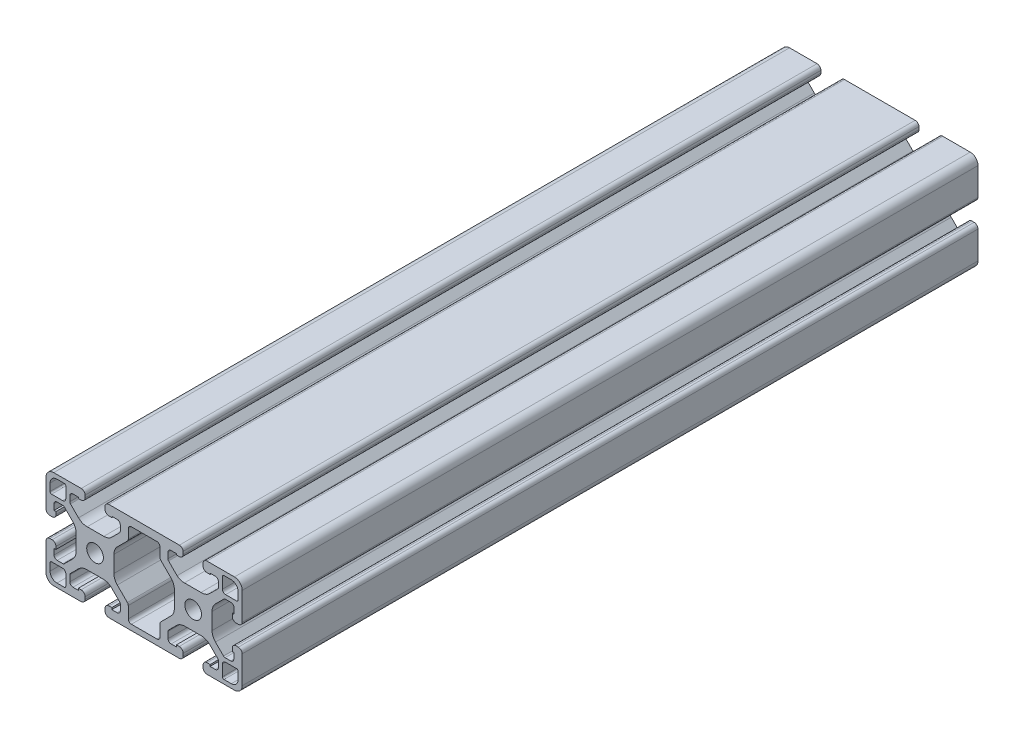
from build123d import *

# Parameters (mm, degrees)
SKETCH1_R      = 3.4
EXTRUDE1_DEPTH = 300


with BuildPart() as part:
    # Sketch1 → Extrude1 (new body)
    with BuildSketch(Plane.XY):
        with BuildLine():
            Line((-14.38, 20), (14.38, 20))
            ThreePointArc((14.38, 20), (15.425738649, 19.60103829), (15.94, 18.60691806))
            Line((15.94, 18.60691806), (15.94, 17.51))
            ThreePointArc((15.94, 17.51), (15.480157646, 16.399842354), (14.37, 15.94))
            Line((14.37, 15.94), (13.151704673, 15.94))
            Line((13.151704673, 15.94), (13.151704673, 16.411729227))
            Line((13.151704673, 16.411729227), (11.043737435, 16.411729227))
            ThreePointArc((11.043737435, 16.411729227), (10.108071893, 16.061726996), (9.715, 15.143322914))
            Line((9.715, 15.143322914), (9.715, 12.847645092))
            ThreePointArc((9.715, 12.847645092), (9.782853417, 12.506800558), (9.976067406, 12.217927859))
            Line((9.976067406, 12.217927859), (13.458633337, 8.739701268))
            ThreePointArc((13.458633337, 8.739701268), (14.85623797, 7.966343661), (16.431179797, 7.7))
            Line((16.431179797, 7.7), (23.18718254, 7.7))
            ThreePointArc((23.18718254, 7.7), (25.111909818, 8.02014308), (26.745550907, 9.087046766))
            Line((26.745550907, 9.087046766), (30.024325035, 12.365820894))
            ThreePointArc((30.024325035, 12.365820894), (30.217252784, 12.654557674), (30.285, 12.995145929))
            Line((30.285, 12.995145929), (30.285, 15.086937017))
            ThreePointArc((30.285, 15.086937017), (29.913025612, 15.984962629), (29.015, 16.356937017))
            Line((29.015, 16.356937017), (26.848295327, 16.356937017))
            Line((26.848295327, 16.356937017), (26.848295327, 15.88520779))
            Line((26.848295327, 15.88520779), (25.63, 15.88520779))
            ThreePointArc((25.63, 15.88520779), (24.519842354, 16.345050144), (24.06, 17.45520779))
            Line((24.06, 17.45520779), (24.06, 18.43))
            ThreePointArc((24.06, 18.43), (24.519842354, 19.540157646), (25.63, 20))
            Line((25.63, 20), (34.281820422, 20))
            Line((34.281820422, 20), (36.83, 20))
            ThreePointArc((36.83, 20), (39.071528496, 19.071528496), (40, 16.83))
            Line((40, 16.83), (40, 13))
            Line((40, 13), (40, 5.571883806))
            ThreePointArc((40, 5.571883806), (39.520105381, 4.499108397), (38.43, 4.06))
            Line((38.43, 4.06), (37.51, 4.06))
            ThreePointArc((37.51, 4.06), (36.399842354, 4.519842354), (35.94, 5.63))
            Line((35.94, 5.63), (35.94, 6.696410101))
            Line((35.94, 6.696410101), (36.715022223, 6.696410101))
            Line((36.715022223, 6.696410101), (36.715022223, 9.02))
            ThreePointArc((36.715022223, 9.02), (36.343047835, 9.918025612), (35.445022223, 10.29))
            Line((35.445022223, 10.29), (33.15011805, 10.29))
            ThreePointArc((33.15011805, 10.29), (32.809529795, 10.222252784), (32.520793015, 10.029325035))
            Line((32.520793015, 10.029325035), (29.091242789, 6.59977481))
            ThreePointArc((29.091242789, 6.59977481), (28.061572221, 5.058763903), (27.7, 3.241017599))
            Line((27.7, 3.241017599), (27.7, -3.514985144))
            ThreePointArc((27.7, -3.514985144), (28.061005845, -5.331363493), (29.089149602, -6.871647862))
            Line((29.089149602, -6.871647862), (32.377834665, -10.164435797))
            ThreePointArc((32.377834665, -10.164435797), (32.666707364, -10.357649787), (33.007551897, -10.425503204))
            Line((33.007551897, -10.425503204), (35.30245607, -10.425503204))
            ThreePointArc((35.30245607, -10.425503204), (36.200481682, -10.053528816), (36.57245607, -9.155503204))
            Line((36.57245607, -9.155503204), (36.57245607, -6.779901474))
            Line((36.57245607, -6.779901474), (35.94, -6.779901474))
            Line((35.94, -6.779901474), (35.94, -5.569550674))
            ThreePointArc((35.94, -5.569550674), (36.399842354, -4.459393028), (37.51, -3.999550674))
            Line((37.51, -3.999550674), (38.43, -3.999550674))
            ThreePointArc((38.43, -3.999550674), (39.540157646, -4.459393028), (40, -5.569550674))
            Line((40, -5.569550674), (40, -16.83))
            ThreePointArc((40, -16.83), (39.071528496, -19.071528496), (36.83, -20))
            Line((36.83, -20), (34.322274694, -20))
            Line((34.322274694, -20), (25.694366927, -20))
            ThreePointArc((25.694366927, -20), (24.542361223, -19.563549297), (24.06, -18.43))
            Line((24.06, -18.43), (24.06, -17.45520779))
            ThreePointArc((24.06, -17.45520779), (24.519842354, -16.345050144), (25.63, -15.88520779))
            Line((25.63, -15.88520779), (26.907032762, -15.88520779))
            Line((26.907032762, -15.88520779), (26.907032762, -16.558380889))
            Line((26.907032762, -16.558380889), (29.015, -16.558380889))
            ThreePointArc((29.015, -16.558380889), (29.913025612, -16.186406501), (30.285, -15.288380889))
            Line((30.285, -15.288380889), (30.285, -12.829086847))
            ThreePointArc((30.285, -12.829086847), (30.217252784, -12.488498592), (30.024325035, -12.199761812))
            Line((30.024325035, -12.199761812), (26.739188515, -8.914625291))
            ThreePointArc((26.739188515, -8.914625291), (25.199545386, -7.885521524), (23.383392441, -7.523383425))
            Line((23.383392441, -7.523383425), (16.616607559, -7.523383425))
            ThreePointArc((16.616607559, -7.523383425), (14.800454614, -7.885521524), (13.260811485, -8.914625291))
            Line((13.260811485, -8.914625291), (9.975674965, -12.199761812))
            ThreePointArc((9.975674965, -12.199761812), (9.782747216, -12.488498592), (9.715, -12.829086847))
            Line((9.715, -12.829086847), (9.715, -15.368632076))
            ThreePointArc((9.715, -15.368632076), (10.130220021, -16.230780274), (11.029322361, -16.558380889))
            Line((11.029322361, -16.558380889), (13.171749239, -16.558380889))
            Line((13.171749239, -16.558380889), (13.171749239, -15.813027771))
            Line((13.171749239, -15.813027771), (14.305632598, -15.813027771))
            ThreePointArc((14.305632598, -15.813027771), (15.461304871, -16.2917229), (15.94, -17.447395173))
            Line((15.94, -17.447395173), (15.94, -18.365632122))
            ThreePointArc((15.94, -18.365632122), (15.461305207, -19.521304535), (14.305633073, -20))
            Line((14.305633073, -20), (6.939550674, -20))
            Line((6.939550674, -20), (-6.939550674, -20))
            Line((-6.939550674, -20), (-14.305633073, -20))
            ThreePointArc((-14.305633073, -20), (-15.461305207, -19.521304535), (-15.94, -18.365632122))
            Line((-15.94, -18.365632122), (-15.94, -17.447395173))
            ThreePointArc((-15.94, -17.447395173), (-15.461304871, -16.2917229), (-14.305632598, -15.813027771))
            Line((-14.305632598, -15.813027771), (-13.171749239, -15.813027771))
            Line((-13.171749239, -15.813027771), (-13.171749239, -16.558380889))
            Line((-13.171749239, -16.558380889), (-11.029322361, -16.558380889))
            ThreePointArc((-11.029322361, -16.558380889), (-10.130220021, -16.230780274), (-9.715, -15.368632076))
            Line((-9.715, -15.368632076), (-9.715, -12.829086847))
            ThreePointArc((-9.715, -12.829086847), (-9.782747216, -12.488498592), (-9.975674965, -12.199761812))
            Line((-9.975674965, -12.199761812), (-13.260811485, -8.914625291))
            ThreePointArc((-13.260811485, -8.914625291), (-14.800454614, -7.885521524), (-16.616607559, -7.523383425))
            Line((-16.616607559, -7.523383425), (-23.383392441, -7.523383425))
            ThreePointArc((-23.383392441, -7.523383425), (-25.199545386, -7.885521524), (-26.739188515, -8.914625291))
            Line((-26.739188515, -8.914625291), (-30.024325035, -12.199761812))
            ThreePointArc((-30.024325035, -12.199761812), (-30.217252784, -12.488498592), (-30.285, -12.829086847))
            Line((-30.285, -12.829086847), (-30.285, -15.288380889))
            ThreePointArc((-30.285, -15.288380889), (-29.913025612, -16.186406501), (-29.015, -16.558380889))
            Line((-29.015, -16.558380889), (-26.828250761, -16.558380889))
            Line((-26.828250761, -16.558380889), (-26.828250761, -15.813027771))
            Line((-26.828250761, -15.813027771), (-25.694367402, -15.813027771))
            ThreePointArc((-25.694367402, -15.813027771), (-24.538695129, -16.2917229), (-24.06, -17.447395173))
            Line((-24.06, -17.447395173), (-24.06, -18.365632122))
            ThreePointArc((-24.06, -18.365632122), (-24.538694793, -19.521304535), (-25.694366927, -20))
            Line((-25.694366927, -20), (-36.83, -20))
            ThreePointArc((-36.83, -20), (-39.071528496, -19.071528496), (-40, -16.83))
            Line((-40, -16.83), (-40, -5.571883806))
            ThreePointArc((-40, -5.571883806), (-39.520105381, -4.499108397), (-38.43, -4.06))
            Line((-38.43, -4.06), (-37.51, -4.06))
            ThreePointArc((-37.51, -4.06), (-36.399842354, -4.519842354), (-35.94, -5.63))
            Line((-35.94, -5.63), (-35.94, -6.696410101))
            Line((-35.94, -6.696410101), (-36.715022223, -6.696410101))
            Line((-36.715022223, -6.696410101), (-36.715022223, -9.02))
            ThreePointArc((-36.715022223, -9.02), (-36.343047835, -9.918025612), (-35.445022223, -10.29))
            Line((-35.445022223, -10.29), (-33.15011805, -10.29))
            ThreePointArc((-33.15011805, -10.29), (-32.809529795, -10.222252784), (-32.520793015, -10.029325035))
            Line((-32.520793015, -10.029325035), (-29.091242789, -6.59977481))
            ThreePointArc((-29.091242789, -6.59977481), (-28.061572221, -5.058763903), (-27.7, -3.241017599))
            Line((-27.7, -3.241017599), (-27.7, 3.241017599))
            ThreePointArc((-27.7, 3.241017599), (-28.061572221, 5.058763903), (-29.091242789, 6.59977481))
            Line((-29.091242789, 6.59977481), (-32.520793015, 10.029325035))
            ThreePointArc((-32.520793015, 10.029325035), (-32.809529795, 10.222252784), (-33.15011805, 10.29))
            Line((-33.15011805, 10.29), (-35.445022223, 10.29))
            ThreePointArc((-35.445022223, 10.29), (-36.343047835, 9.918025612), (-36.715022223, 9.02))
            Line((-36.715022223, 9.02), (-36.715022223, 6.696410101))
            Line((-36.715022223, 6.696410101), (-35.94, 6.696410101))
            Line((-35.94, 6.696410101), (-35.94, 5.63))
            ThreePointArc((-35.94, 5.63), (-36.399842354, 4.519842354), (-37.51, 4.06))
            Line((-37.51, 4.06), (-38.43, 4.06))
            ThreePointArc((-38.43, 4.06), (-39.520105381, 4.499108397), (-40, 5.571883806))
            Line((-40, 5.571883806), (-40, 13))
            Line((-40, 13), (-40, 16.83))
            ThreePointArc((-40, 16.83), (-39.071528496, 19.071528496), (-36.83, 20))
            Line((-36.83, 20), (-25.63, 20))
            ThreePointArc((-25.63, 20), (-24.519842354, 19.540157646), (-24.06, 18.43))
            Line((-24.06, 18.43), (-24.06, 17.45520779))
            ThreePointArc((-24.06, 17.45520779), (-24.519842354, 16.345050144), (-25.63, 15.88520779))
            Line((-25.63, 15.88520779), (-26.848295327, 15.88520779))
            Line((-26.848295327, 15.88520779), (-26.848295327, 16.356937017))
            Line((-26.848295327, 16.356937017), (-29.015, 16.356937017))
            ThreePointArc((-29.015, 16.356937017), (-29.913025612, 15.984962629), (-30.285, 15.086937017))
            Line((-30.285, 15.086937017), (-30.285, 12.995145929))
            ThreePointArc((-30.285, 12.995145929), (-30.217252784, 12.654557674), (-30.024325035, 12.365820894))
            Line((-30.024325035, 12.365820894), (-26.745550907, 9.087046766))
            ThreePointArc((-26.745550907, 9.087046766), (-25.111909818, 8.02014308), (-23.18718254, 7.7))
            Line((-23.18718254, 7.7), (-16.431179797, 7.7))
            ThreePointArc((-16.431179797, 7.7), (-14.85623797, 7.966343661), (-13.458633337, 8.739701268))
            Line((-13.458633337, 8.739701268), (-9.976067406, 12.217927859))
            ThreePointArc((-9.976067406, 12.217927859), (-9.782853417, 12.506800558), (-9.715, 12.847645092))
            Line((-9.715, 12.847645092), (-9.715, 15.143322914))
            ThreePointArc((-9.715, 15.143322914), (-10.108071893, 16.061726996), (-11.043737435, 16.411729227))
            Line((-11.043737435, 16.411729227), (-13.151704673, 16.411729227))
            Line((-13.151704673, 16.411729227), (-13.151704673, 15.94))
            Line((-13.151704673, 15.94), (-14.37, 15.94))
            ThreePointArc((-14.37, 15.94), (-15.480157646, 16.399842354), (-15.94, 17.51))
            Line((-15.94, 17.51), (-15.94, 18.60691806))
            ThreePointArc((-15.94, 18.60691806), (-15.425738649, 19.60103829), (-14.38, 20))
        make_face()
        with Locations((-20, 0)):
            Circle(SKETCH1_R, mode=Mode.SUBTRACT)
        with Locations(Location((20, 0, 0), (0, 0, 180))):
            Circle(SKETCH1_R, mode=Mode.SUBTRACT)
        with BuildLine():
            Line((-10.939717555, -6.735226492), (-6.832379884, -10.842564163))
            ThreePointArc((-6.832379884, -10.842564163), (-6.55707849, -11.254581816), (-6.460405496, -11.740589775))
            Line((-6.460405496, -11.740589775), (-6.460405496, -16.447436081))
            ThreePointArc((-6.460405496, -16.447436081), (-6.088431108, -17.345461693), (-5.190405496, -17.717436081))
            Line((-5.190405496, -17.717436081), (5.190405496, -17.717436081))
            ThreePointArc((5.190405496, -17.717436081), (6.088431108, -17.345461693), (6.460405496, -16.447436081))
            Line((6.460405496, -16.447436081), (6.460405496, -11.740589775))
            ThreePointArc((6.460405496, -11.740589775), (6.55707849, -11.254581816), (6.832379884, -10.842564163))
            Line((6.832379884, -10.842564163), (10.939717555, -6.735226492))
            ThreePointArc((10.939717555, -6.735226492), (11.968427261, -5.193573991), (12.328866234, -3.375602637))
            Line((12.328866234, -3.375602637), (12.324653274, 3.382462451))
            ThreePointArc((12.324653274, 3.382462451), (11.961947946, 5.199982999), (10.931316915, 6.740351712))
            Line((10.931316915, 6.740351712), (6.82141954, 10.845128082))
            ThreePointArc((6.82141954, 10.845128082), (6.546118146, 11.257145735), (6.449445152, 11.743153694))
            Line((6.449445152, 11.743153694), (6.449445152, 15.43))
            ThreePointArc((6.449445152, 15.43), (6.077472135, 16.328024243), (5.179449028, 16.700000002))
            Line((5.179449028, 16.700000002), (-1.006e-06, 16.696771148))
            Line((-1.006e-06, 16.696771148), (-5.179449028, 16.700000002))
            ThreePointArc((-5.179449028, 16.700000002), (-6.077472135, 16.328024243), (-6.449445152, 15.43))
            Line((-6.449445152, 15.43), (-6.449445152, 11.743153694))
            ThreePointArc((-6.449445152, 11.743153694), (-6.546118146, 11.257145735), (-6.82141954, 10.845128082))
            Line((-6.82141954, 10.845128082), (-10.931316915, 6.740351712))
            ThreePointArc((-10.931316915, 6.740351712), (-11.961947946, 5.199982999), (-12.324653274, 3.382462451))
            Line((-12.324653274, 3.382462451), (-12.328866234, -3.375602637))
            ThreePointArc((-12.328866234, -3.375602637), (-11.968427261, -5.193573991), (-10.939717555, -6.735226492))
        make_face(mode=Mode.SUBTRACT)
        with BuildLine():
            Line((-37.72, 11.94), (-33.21, 11.94))
            ThreePointArc((-33.21, 11.94), (-32.308740411, 12.310201988), (-31.935, 13.21))
            Line((-31.935, 13.21), (-31.935, 17.72))
            ThreePointArc((-31.935, 17.72), (-32.119522728, 18.165477272), (-32.565, 18.35))
            Line((-32.565, 18.35), (-35.545, 18.35))
            ThreePointArc((-35.545, 18.35), (-37.524898987, 17.529898987), (-38.345, 15.55))
            Line((-38.345, 15.55), (-38.345, 12.57))
            ThreePointArc((-38.345, 12.57), (-38.162248533, 12.126281217), (-37.72, 11.94))
        make_face(mode=Mode.SUBTRACT)
        with BuildLine():
            Line((-31.935, -17.72), (-31.935, -13.21))
            ThreePointArc((-31.935, -13.21), (-32.308740411, -12.310201988), (-33.21, -11.94))
            Line((-33.21, -11.94), (-37.72, -11.94))
            ThreePointArc((-37.72, -11.94), (-38.162248533, -12.126281217), (-38.345, -12.57))
            Line((-38.345, -12.57), (-38.345, -15.55))
            ThreePointArc((-38.345, -15.55), (-37.524898987, -17.529898987), (-35.545, -18.35))
            Line((-35.545, -18.35), (-32.565, -18.35))
            ThreePointArc((-32.565, -18.35), (-32.119522728, -18.165477272), (-31.935, -17.72))
        make_face(mode=Mode.SUBTRACT)
        with BuildLine():
            Line((38.345, -15.55), (38.345, -12.57))
            ThreePointArc((38.345, -12.57), (38.162248533, -12.126281217), (37.72, -11.94))
            Line((37.72, -11.94), (33.21, -11.94))
            ThreePointArc((33.21, -11.94), (32.308740411, -12.310201988), (31.935, -13.21))
            Line((31.935, -13.21), (31.935, -17.72))
            ThreePointArc((31.935, -17.72), (32.119522728, -18.165477272), (32.565, -18.35))
            Line((32.565, -18.35), (35.545, -18.35))
            ThreePointArc((35.545, -18.35), (37.524898987, -17.529898987), (38.345, -15.55))
        make_face(mode=Mode.SUBTRACT)
        with BuildLine():
            Line((38.345, 15.55), (38.345, 12.57))
            ThreePointArc((38.345, 12.57), (38.162248533, 12.126281217), (37.72, 11.94))
            Line((37.72, 11.94), (33.21, 11.94))
            ThreePointArc((33.21, 11.94), (32.308740411, 12.310201988), (31.935, 13.21))
            Line((31.935, 13.21), (31.935, 17.72))
            ThreePointArc((31.935, 17.72), (32.119522728, 18.165477272), (32.565, 18.35))
            Line((32.565, 18.35), (35.545, 18.35))
            ThreePointArc((35.545, 18.35), (37.524898987, 17.529898987), (38.345, 15.55))
        make_face(mode=Mode.SUBTRACT)
    extrude(amount=-EXTRUDE1_DEPTH)


solid = part.part
